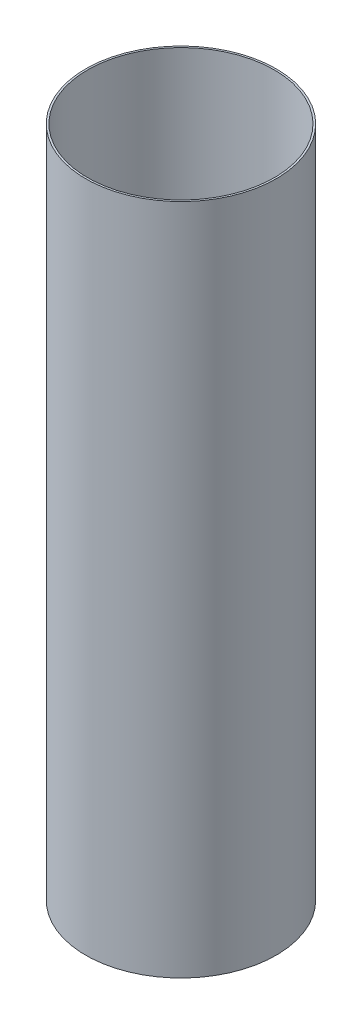
from build123d import *

# Parameters (mm, degrees)
SKETCH_1_R      = 51
SKETCH_1_R_2    = 50
EXTRUDE_1_DEPTH = 360


with BuildPart() as part:
    # Эскиз1 → Бобышка-Вытянуть1 (new body)
    with BuildSketch(Plane(origin=(0, 0, 0), x_dir=(1, 0, 0), z_dir=(0, 1, 0))):
        with Locations(Location((0, 0, 0), (0, 0, 90))):
            Circle(SKETCH_1_R)
        with Locations(Location((0, 0, 0), (0, 0, 90))):
            Circle(SKETCH_1_R_2, mode=Mode.SUBTRACT)
    extrude(amount=EXTRUDE_1_DEPTH)


solid = part.part
